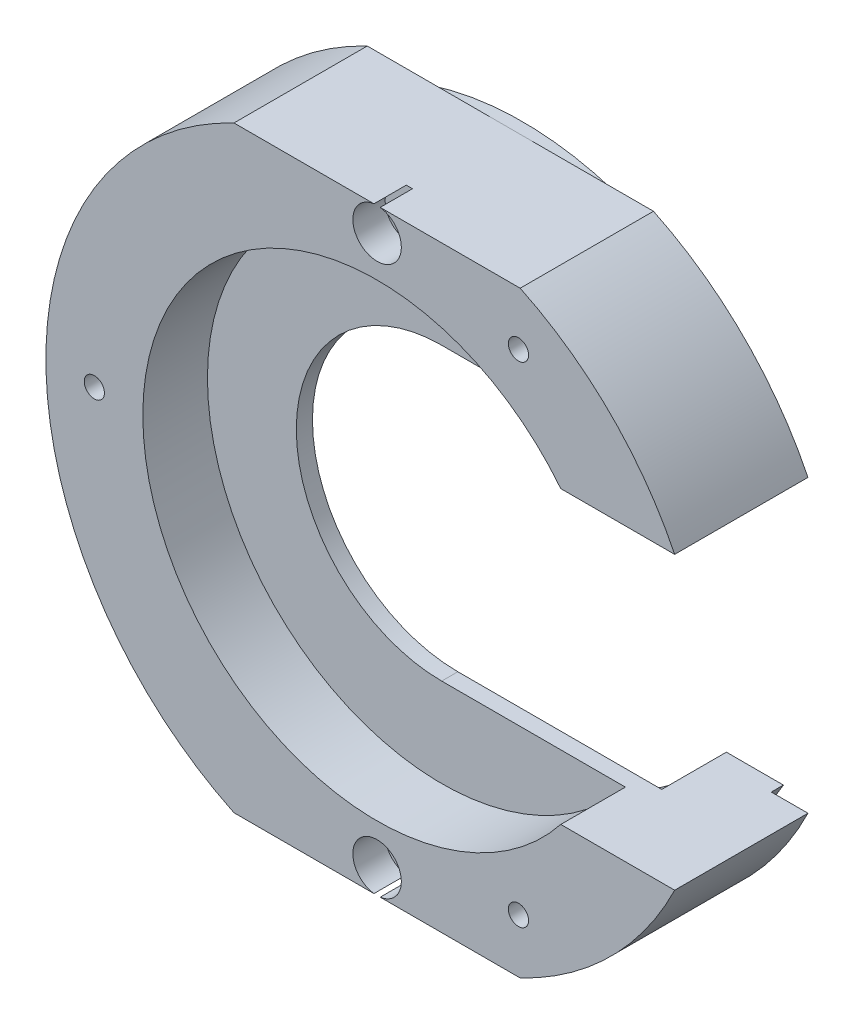
from build123d import *

# Parameters (mm, degrees)
SKETCH_1_R                   = 41
EXTRUDE_1_DEPTH              = 16.5
SKETCH_2_R                   = 36.975
EXTRUDE_2_DEPTH              = 1.5
SKETCH_4_W                   = 50
SKETCH_4_H                   = 6.84002239
CUT_EXTRUDE_1_DEPTH          = 61.712436947
SKETCH_5_R                   = 31
CUT_EXTRUDE_3_DEPTH          = 8
SKETCH_6_R                   = 29
CUT_EXTRUDE_4_DEPTH          = 8
CUT_EXTRUDE_5_DEPTH          = 57.108382841
CUT_EXTRUDE_5_DEPTH_BACK     = 57.108382841
HOLE_WIZARD_M3_3_D           = 3.5
HOLE_WIZARD_M3_3_CBORE_D     = 6
HOLE_WIZARD_M3_3_CBORE_DEPTH = 4
HOLE_WIZARD_M3_1_D           = 2.5
PATTERN_CIRCULAR_1_COUNT     = 3


with BuildPart() as part:
    # 草图1 → 凸台-拉伸1 (new body)
    with BuildSketch(Plane.XY):
        Circle(SKETCH_1_R)
    extrude(amount=EXTRUDE_1_DEPTH)

    # 草图2 → 凸台-拉伸2 (add)
    with BuildSketch(Plane(origin=(0, 0, 0), x_dir=(-1, 0, 0), z_dir=(0, 0, -1))):
        Circle(SKETCH_2_R)
    extrude(amount=EXTRUDE_2_DEPTH)

    # 草图4 → 切除-拉伸1 (cut, through all)
    with BuildSketch(Plane(origin=(0, 0, -1.5), x_dir=(-1, 0, 0), z_dir=(0, 0, -1))):
        with Locations((0, 40.395011195)):
            Rectangle(SKETCH_4_W, SKETCH_4_H)
        with Locations((0, -40.395011195)):
            Rectangle(SKETCH_4_W, SKETCH_4_H)
    extrude(amount=-CUT_EXTRUDE_1_DEPTH, mode=Mode.SUBTRACT)

    # 草图5 → 切除-拉伸3 (cut)
    with BuildSketch(Plane(origin=(0, 0, -1.5), x_dir=(-1, 0, 0), z_dir=(0, 0, -1))):
        Circle(SKETCH_5_R)
    extrude(amount=-CUT_EXTRUDE_3_DEPTH, mode=Mode.SUBTRACT)

    # 草图6 → 切除-拉伸4 (cut)
    with BuildSketch(Plane.XY.offset(16.5)):
        Circle(SKETCH_6_R)
    extrude(amount=-CUT_EXTRUDE_4_DEPTH, mode=Mode.SUBTRACT)

    # 草图7 → 切除-拉伸5 (cut, two sides: drawn at the far end of the back side and taken through both)
    with BuildSketch(Plane.XY.offset(8.5).offset(-CUT_EXTRUDE_5_DEPTH_BACK)):
        with BuildLine():
            Line((0, 18), (36.837480913, 18))
            ThreePointArc((36.837480913, 18), (41, 0), (36.837480913, -18))
            Line((36.837480913, -18), (0, -18))
            ThreePointArc((0, -18), (-18, 0), (0, 18))
        make_face()
    extrude(amount=CUT_EXTRUDE_5_DEPTH + CUT_EXTRUDE_5_DEPTH_BACK, mode=Mode.SUBTRACT)

    # M3 六角头螺栓的柱形沉头孔3 (through all)
    with Locations(Plane(origin=(0, 34, 16.5), x_dir=(1, 0, 0), z_dir=(0, 0, 1))):
        with Locations((0, 0), (0, -68)):
            CounterBoreHole(HOLE_WIZARD_M3_3_D / 2, HOLE_WIZARD_M3_3_CBORE_D / 2, HOLE_WIZARD_M3_3_CBORE_DEPTH)

    # M3 螺纹孔1 (through all)
    with Locations(Plane(origin=(-35, 0, 16.5), x_dir=(1, 0, 0), z_dir=(0, 0, 1))):
        with Locations((0, 0)):
            hole_wizard_m3_1 = Hole(HOLE_WIZARD_M3_1_D / 2)

    # 阵列(圆周)1: M3 螺纹孔1 ×3 about axis
    pattern_circular_1_axis = Axis((0, 0, 0), (0, 0, 1))
    for i in range(1, PATTERN_CIRCULAR_1_COUNT):
        add(hole_wizard_m3_1.rotate(pattern_circular_1_axis, i * 360 / PATTERN_CIRCULAR_1_COUNT), mode=Mode.SUBTRACT)


solid = part.part
